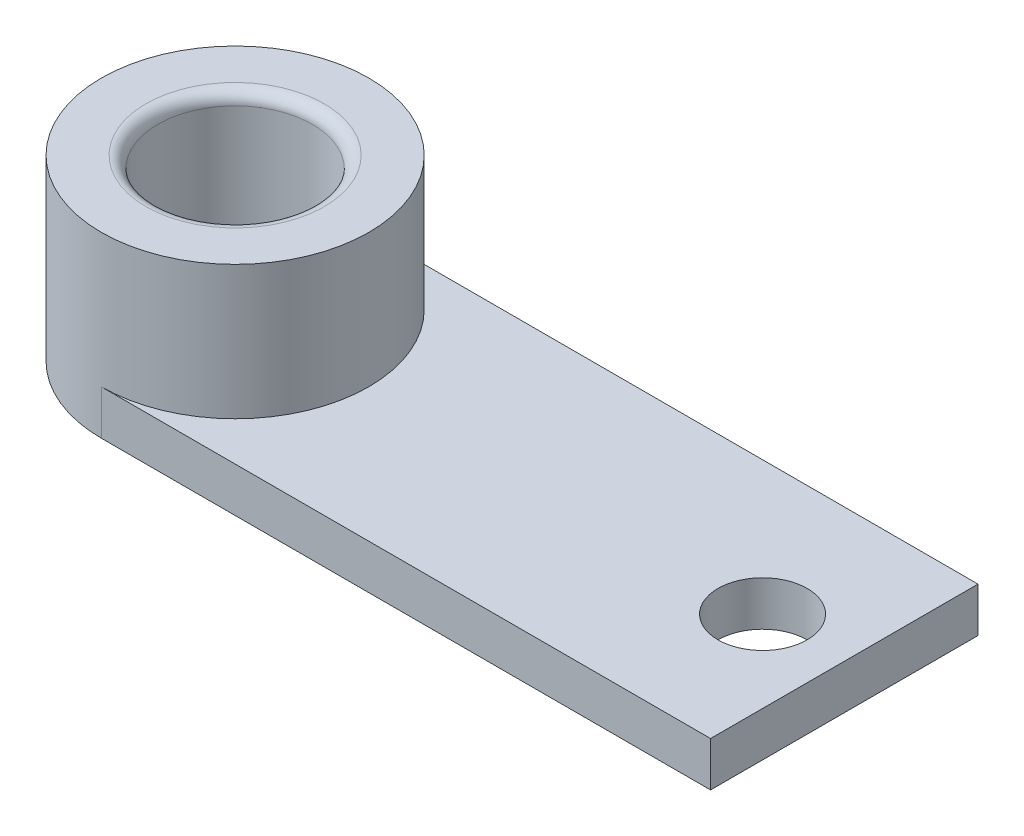
from build123d import *

# Parameters (mm, degrees)
SKETCH2_W               = 25
SKETCH2_H               = 9
BOSS_EXTRUDE3_DEPTH     = 6
SKETCH3_R               = 2.6
CUT_EXTRUDE1_DEPTH      = 5
CUT_EXTRUDE2_DEPTH      = 28.239676944
CUT_EXTRUDE2_DEPTH_BACK = 28.239676944
SKETCH4_R               = 1.5
SKETCH5_R               = 1.5
CUT_EXTRUDE3_DEPTH      = 4.5
CUT_EXTRUDE4_DEPTH      = 28.239676944
FILLET2_R               = 0.4


with BuildPart() as part:
    # Sketch2 → Boss-Extrude3 (new body)
    with BuildSketch(Plane(origin=(0, 0, 0), x_dir=(1, 0, 0), z_dir=(0, 1, 0))):
        with Locations((12.5, 4.5)):
            Rectangle(SKETCH2_W, SKETCH2_H)
    extrude(amount=BOSS_EXTRUDE3_DEPTH)

    # Sketch3 → Cut-Extrude1 (cut)
    with BuildSketch(Plane(origin=(0, 6, 0), x_dir=(1, 0, 0), z_dir=(0, 1, 0))):
        with Locations(Location((4.5, 4.5, 0), (0, 0, 270))):
            Circle(SKETCH3_R)
    extrude(amount=-CUT_EXTRUDE1_DEPTH, mode=Mode.SUBTRACT)

    # Sketch4 → Cut-Extrude2 (cut, two sides: drawn at the far end of the back side and taken through both)
    with BuildSketch(Plane(origin=(0, 6, 0), x_dir=(1, 0, 0), z_dir=(0, 1, 0)).offset(-CUT_EXTRUDE2_DEPTH_BACK)):
        with Locations(Location((22.25, 4.5, 0), (0, 0, 270))):
            Circle(SKETCH4_R)
    extrude(amount=CUT_EXTRUDE2_DEPTH + CUT_EXTRUDE2_DEPTH_BACK, mode=Mode.SUBTRACT)

    # Sketch5 → Cut-Extrude3 (cut)
    with BuildSketch(Plane(origin=(0, 6, 0), x_dir=(1, 0, 0), z_dir=(0, 1, 0))):
        with BuildLine():
            Line((25, 9), (4.5, 9))
            ThreePointArc((4.5, 9), (7.681980515, 7.681980515), (9, 4.5))
            ThreePointArc((9, 4.5), (7.681980515, 1.318019485), (4.5, 0))
            Line((4.5, 0), (25, 0))
            Line((25, 0), (25, 9))
        make_face()
        with Locations(Location((22.25, 4.5, 0), (0, 0, 270))):
            Circle(SKETCH5_R, mode=Mode.SUBTRACT)
    extrude(amount=-CUT_EXTRUDE3_DEPTH, mode=Mode.SUBTRACT)

    # Sketch6 → Cut-Extrude4 (cut, through all)
    with BuildSketch(Plane(origin=(0, 6, 0), x_dir=(1, 0, 0), z_dir=(0, 1, 0))):
        with BuildLine():
            ThreePointArc((0, 4.5), (1.318019485, 7.681980515), (4.5, 9))
            Line((4.5, 9), (0, 9))
            Line((0, 9), (0, 4.5))
        make_face()
        with BuildLine():
            ThreePointArc((4.5, 0), (1.318019485, 1.318019485), (0, 4.5))
            Line((0, 4.5), (0, 0))
            Line((0, 0), (4.5, 0))
        make_face()
    extrude(amount=-CUT_EXTRUDE4_DEPTH, mode=Mode.SUBTRACT)

    # Fillet2
    fillet2_edges = [part.edges().sort_by_distance(p)[0] for p in [
        (4.5, 6, -7.1),
    ]]
    fillet(fillet2_edges, radius=FILLET2_R)


solid = part.part
